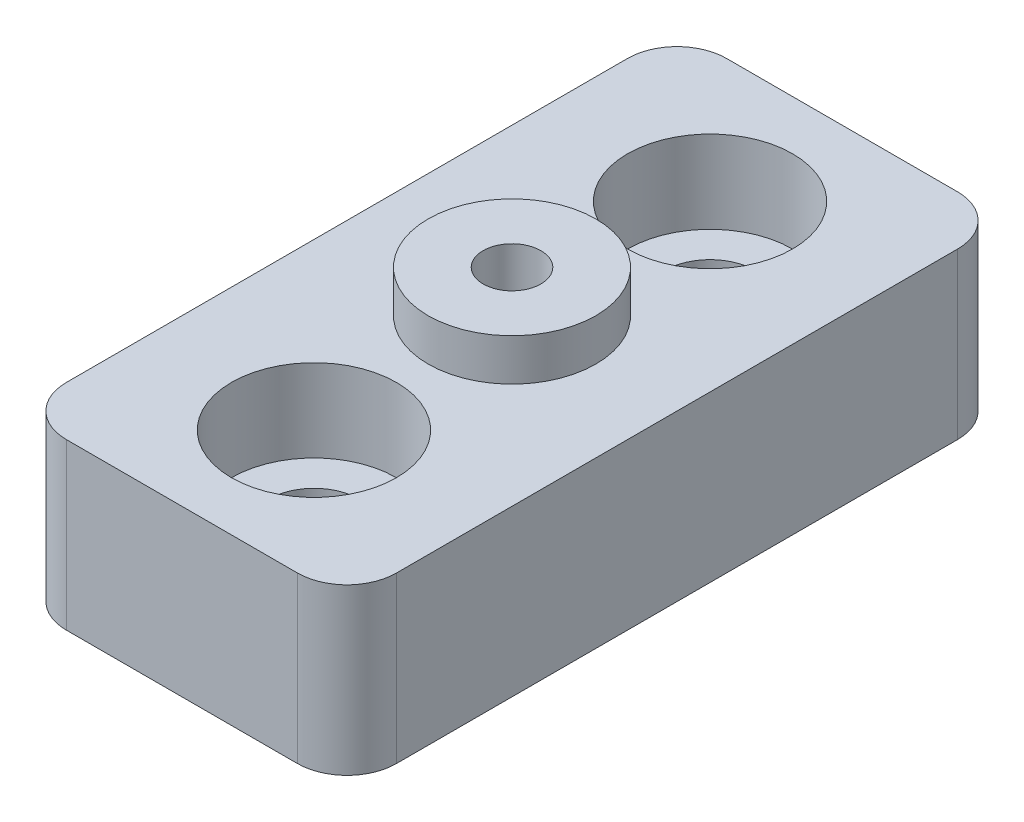
from build123d import *

# Parameters (mm, degrees)
SKETCH1_W                      = 20
SKETCH1_H                      = 40
BOSS_EXTRUDE1_DEPTH            = 10
CUT_EXTRUDE1_START             = -2
CUT_EXTRUDE1_DEPTH             = 23.494897428
CUT_EXTRUDE1_DRAFT             = 1
SKETCH4_R                      = 5.08
BOSS_EXTRUDE2_DEPTH            = 2.54
SKETCH5_R                      = 1.75
CUT_EXTRUDE2_DEPTH             = 24.748684174
CBORE_FOR_M5_SHCS1_D           = 5.5
CBORE_FOR_M5_SHCS1_DEPTH       = 12
CBORE_FOR_M5_SHCS1_CBORE_D     = 10
CBORE_FOR_M5_SHCS1_CBORE_DEPTH = 5
CBORE_FOR_M5_SHCS1_TIP         = 1.652366702
FILLET1_R                      = 3


with BuildPart() as part:
    # Sketch1 → Boss-Extrude1 (new body)
    with BuildSketch(Plane(origin=(0, 0, 0), x_dir=(1, 0, 0), z_dir=(0, 1, 0))):
        Rectangle(SKETCH1_W, SKETCH1_H)
    extrude(amount=BOSS_EXTRUDE1_DEPTH)


with BuildPart() as cut_extrude1_tool:
    # Sketch3 → Cut-Extrude1 (with draft: the straight prism first)
    with BuildSketch(Plane(origin=(0, 10, 0), x_dir=(1, 0, 0), z_dir=(0, 1, 0)).offset(CUT_EXTRUDE1_START)):
        Polygon((3.175426481, 0), (1.58771324, 2.75), (-1.58771324, 2.75), (-3.175426481, 0), (-1.58771324, -2.75), (1.58771324, -2.75), align=None)
    extrude(amount=-CUT_EXTRUDE1_DEPTH)
    # Cut-Extrude1: the draft: its side faces are tilted about the plane it starts from
    cut_extrude1_sides = [cut_extrude1_tool.faces().sort_by_distance(p)[0] for p in [
        (2.38156986, -3.747448714, -1.375),
        (0, -3.747448714, -2.75),
        (-2.38156986, -3.747448714, -1.375),
        (-2.38156986, -3.747448714, 1.375),
        (0, -3.747448714, 2.75),
        (2.38156986, -3.747448714, 1.375),
    ]]
    draft(cut_extrude1_sides, Plane(origin=(0, 10, 0), x_dir=(1, 0, 0), z_dir=(0, 1, 0)).offset(CUT_EXTRUDE1_START), CUT_EXTRUDE1_DRAFT)


with BuildPart() as part_1:
    add(part.part)

    # Cut-Extrude1: cut by cut_extrude1_tool
    add(cut_extrude1_tool.part, mode=Mode.SUBTRACT)

    # Sketch4 → Boss-Extrude2 (add)
    with BuildSketch(Plane(origin=(0, 10, 0), x_dir=(1, 0, 0), z_dir=(0, 1, 0))):
        with Locations(Location((0, 0, 0), (0, 0, 270))):
            Circle(SKETCH4_R)
    extrude(amount=BOSS_EXTRUDE2_DEPTH)

    # Sketch5 → Cut-Extrude2 (cut, through all)
    with BuildSketch(Plane.XZ.offset(-8)):
        with Locations(Location((0, 0, 0), (0, 0, 270))):
            Circle(SKETCH5_R)
    extrude(amount=-CUT_EXTRUDE2_DEPTH, mode=Mode.SUBTRACT)

    # CBORE for M5 SHCS1
    with Locations(Plane(origin=(0, 10, 0), x_dir=(1, 0, 0), z_dir=(0, 1, 0))):
        with Locations((0, -12), (0, 12)):
            CounterBoreHole(CBORE_FOR_M5_SHCS1_D / 2, CBORE_FOR_M5_SHCS1_CBORE_D / 2, CBORE_FOR_M5_SHCS1_CBORE_DEPTH, depth=CBORE_FOR_M5_SHCS1_DEPTH)
            with Locations((0, 0, -(CBORE_FOR_M5_SHCS1_DEPTH + CBORE_FOR_M5_SHCS1_TIP / 2))):  # 118° drill point
                Cone(0, CBORE_FOR_M5_SHCS1_D / 2, CBORE_FOR_M5_SHCS1_TIP, mode=Mode.SUBTRACT)

    # Fillet1
    fillet1_edges = [part_1.edges().sort_by_distance(p)[0] for p in [
        (10, 5, 20),
        (-10, 5, 20),
        (-10, 5, -20),
        (10, 5, -20),
    ]]
    fillet(fillet1_edges, radius=FILLET1_R)


solid = part_1.part
